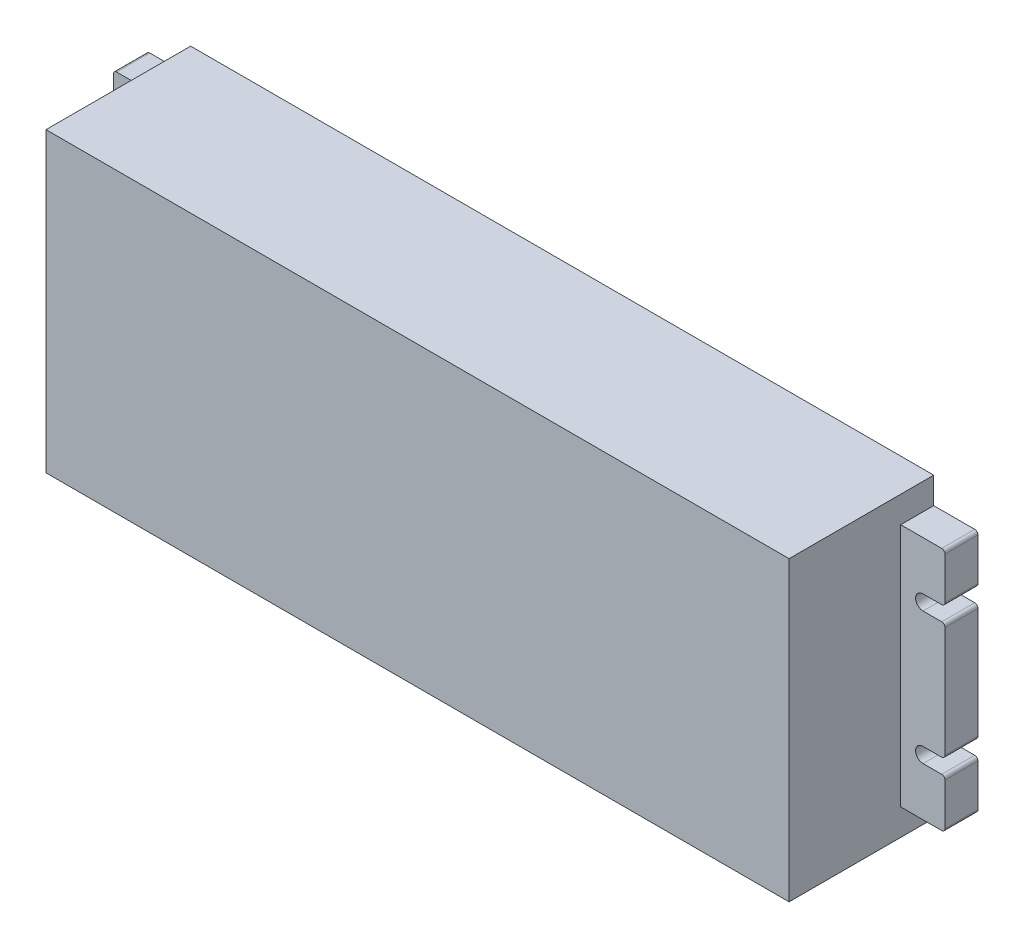
from build123d import *

# Parameters (mm, degrees)
SKETCH1_W           = 225
SKETCH1_H           = 90
BOSS_EXTRUDE1_DEPTH = 43.8
BOSS_EXTRUDE2_DEPTH = 10


with BuildPart() as part:
    # Sketch1 → Boss-Extrude1 (new body)
    with BuildSketch(Plane.XY):
        Rectangle(SKETCH1_W, SKETCH1_H)
    extrude(amount=BOSS_EXTRUDE1_DEPTH)

    # Sketch2 → Boss-Extrude2 (add)
    with BuildSketch(Plane.XY):
        with BuildLine():
            Line((-112.5, 37), (-124.9, 37))
            ThreePointArc((-124.9, 37), (-125.607106781, 36.707106781), (-125.9, 36))
            Line((-125.9, 36), (-125.9, 23.25))
            ThreePointArc((-125.9, 23.25), (-125.607106781, 22.542893219), (-124.9, 22.25))
            Line((-124.9, 22.25), (-119.25, 22.25))
            ThreePointArc((-119.25, 22.25), (-117, 20), (-119.25, 17.75))
            Line((-119.25, 17.75), (-124.9, 17.75))
            ThreePointArc((-124.9, 17.75), (-125.607106781, 17.457106781), (-125.9, 16.75))
            Line((-125.9, 16.75), (-125.9, -16.75))
            ThreePointArc((-125.9, -16.75), (-125.607106781, -17.457106781), (-124.9, -17.75))
            Line((-124.9, -17.75), (-119.25, -17.75))
            ThreePointArc((-119.25, -17.75), (-117, -20), (-119.25, -22.25))
            Line((-119.25, -22.25), (-124.9, -22.25))
            ThreePointArc((-124.9, -22.25), (-125.607106781, -22.542893219), (-125.9, -23.25))
            Line((-125.9, -23.25), (-125.9, -36))
            ThreePointArc((-125.9, -36), (-125.607106781, -36.707106781), (-124.9, -37))
            Line((-124.9, -37), (-112.5, -37))
            Line((-112.5, -37), (-112.5, 37))
        make_face()
    boss_extrude2 = extrude(amount=BOSS_EXTRUDE2_DEPTH)

    # Mirror1: Boss-Extrude2 across plane
    add(boss_extrude2.mirror(Plane(origin=(0, 0, 0), x_dir=(0, 0, 1), z_dir=(1, 0, 0))))


solid = part.part
